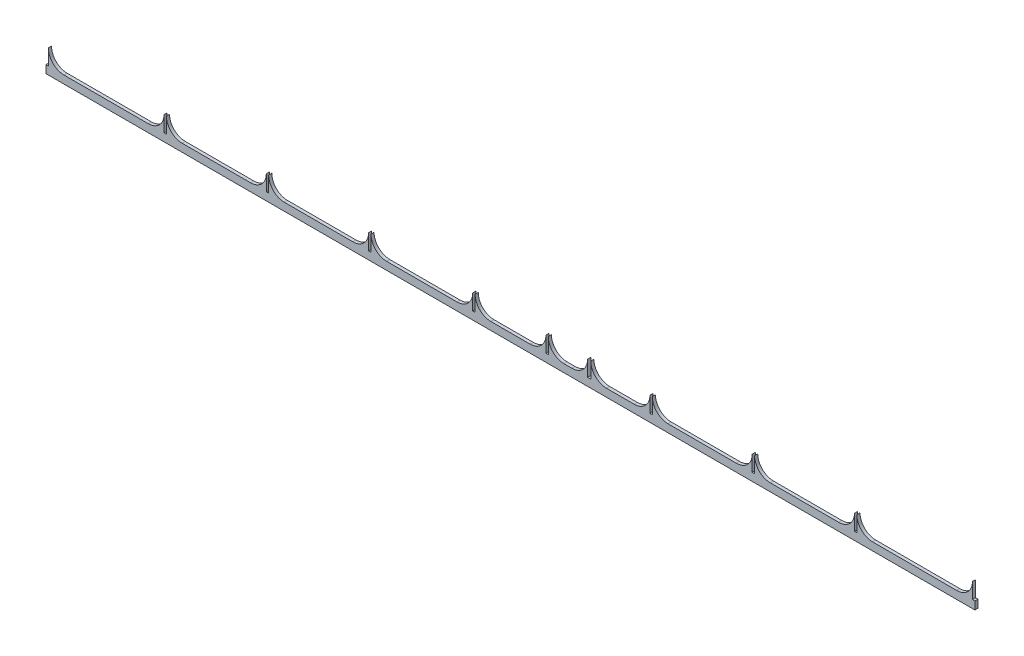
from build123d import *

# Parameters (mm, degrees)
EXTRUDE_1_DEPTH = 2


with BuildPart() as part:
    # Model → 凸台-拉伸1 (new body)
    with BuildSketch(Plane.XY):
        with BuildLine():
            Line((-3.696013755, 8.746558964), (49.803963076, 8.746558964))
            ThreePointArc((49.803963076, 8.746558964), (56.875030888, 11.675491152), (59.803963076, 18.746558964))
            Line((59.803963076, 18.746558964), (59.803963076, 8.746558964))
            Line((59.803963076, 8.746558964), (61.303963076, 8.746558964))
            Line((61.303963076, 8.746558964), (61.303963076, 18.746558964))
            ThreePointArc((61.303963076, 18.746558964), (64.232895264, 11.675491152), (71.303963076, 8.746558964))
            Line((71.303963076, 8.746558964), (114.803939907, 8.746558964))
            ThreePointArc((114.803939907, 8.746558964), (121.875007719, 11.675491152), (124.803939907, 18.746558964))
            Line((124.803939907, 18.746558964), (124.803939907, 8.746558964))
            Line((124.803939907, 8.746558964), (126.303939907, 8.746558964))
            Line((126.303939907, 8.746558964), (126.303939907, 18.746558964))
            ThreePointArc((126.303939907, 18.746558964), (129.232872095, 11.675491152), (136.303939907, 8.746558964))
            Line((136.303939907, 8.746558964), (179.803916738, 8.746558964))
            ThreePointArc((179.803916738, 8.746558964), (186.87498455, 11.675491152), (189.803916738, 18.746558964))
            Line((189.803916738, 18.746558964), (189.803916738, 8.746558964))
            Line((189.803916738, 8.746558964), (191.303916738, 8.746558964))
            Line((191.303916738, 8.746558964), (191.303916738, 18.746558964))
            ThreePointArc((191.303916738, 18.746558964), (194.232848927, 11.675491152), (201.303916739, 8.746558964))
            Line((201.303916739, 8.746558964), (246.003891639, 8.746558964))
            ThreePointArc((246.003891639, 8.746558964), (253.07495945, 11.675491152), (256.003891639, 18.746558964))
            Line((256.003891639, 18.746558964), (256.003891639, 8.746558964))
            Line((256.003891639, 8.746558964), (257.503891639, 8.746558964))
            Line((257.503891639, 8.746558964), (257.503891639, 18.746558964))
            ThreePointArc((257.503891639, 18.746558964), (260.432823827, 11.675491152), (267.503891639, 8.746558964))
            Line((267.503891639, 8.746558964), (275.474891639, 8.746558964))
            Line((275.474891639, 8.746558964), (292.503901751, 8.746558964))
            ThreePointArc((292.503901751, 8.746558964), (299.574969563, 11.675491152), (302.503901751, 18.746558964))
            Line((302.503901751, 18.746558964), (302.503901751, 8.746558964))
            Line((302.503901751, 8.746558964), (304.003901751, 8.746558964))
            Line((304.003901751, 8.746558964), (304.003901751, 18.746558964))
            ThreePointArc((304.003901751, 18.746558964), (306.932833939, 11.675491152), (314.003901751, 8.746558964))
            Line((314.003901751, 8.746558964), (319.003901751, 8.746558964))
            ThreePointArc((319.003901751, 8.746558964), (326.074969563, 11.675491152), (329.003901751, 18.746558964))
            Line((329.003901751, 18.746558964), (329.003901751, 8.746558964))
            Line((329.003901751, 8.746558964), (331.003901751, 8.746558964))
            Line((331.003901751, 8.746558964), (331.003901751, 18.746558964))
            ThreePointArc((331.003901751, 18.746558964), (333.932833939, 11.675491152), (341.003901751, 8.746558964))
            Line((341.003901751, 8.746558964), (358.600293959, 8.746558964))
            ThreePointArc((358.600293959, 8.746558964), (365.671361771, 11.675491152), (368.600293959, 18.746558964))
            Line((368.600293959, 18.746558964), (368.600293959, 8.746558964))
            Line((368.600293959, 8.746558964), (370.100293959, 8.746558964))
            Line((370.100293959, 8.746558964), (370.100293959, 18.746558964))
            ThreePointArc((370.100293959, 18.746558964), (373.029226147, 11.675491152), (380.10029396, 8.746558964))
            Line((380.10029396, 8.746558964), (423.600270791, 8.746558964))
            ThreePointArc((423.600270791, 8.746558964), (430.671338603, 11.675491152), (433.600270791, 18.746558964))
            Line((433.600270791, 18.746558964), (433.600270791, 8.746558964))
            Line((433.600270791, 8.746558964), (435.100270791, 8.746558964))
            Line((435.100270791, 8.746558964), (435.100270791, 18.746558964))
            ThreePointArc((435.100270791, 18.746558964), (438.029202979, 11.675491152), (445.100270791, 8.746558964))
            Line((445.100270791, 8.746558964), (488.600247622, 8.746558964))
            ThreePointArc((488.600247622, 8.746558964), (495.671315434, 11.675491152), (498.600247622, 18.746558964))
            Line((498.600247622, 18.746558964), (498.600247622, 8.746558964))
            Line((498.600247622, 8.746558964), (500.100247622, 8.746558964))
            Line((500.100247622, 8.746558964), (500.100247622, 18.746558964))
            ThreePointArc((500.100247622, 18.746558964), (503.02917981, 11.675491152), (510.100247622, 8.746558964))
            Line((510.100247622, 8.746558964), (563.600224453, 8.746558964))
            ThreePointArc((563.600224453, 8.746558964), (570.671292265, 11.675491152), (573.600224453, 18.746558964))
            Line((573.600224453, 18.746558964), (573.600224453, 8.746558964))
            Line((573.600224453, 8.746558964), (575.100224453, 8.746558964))
            Line((575.100224453, 8.746558964), (575.100224453, 3.746558964))
            Line((575.100224453, 3.746558964), (-15.196013755, 3.746558964))
            Line((-15.196013755, 3.746558964), (-15.196013755, 8.746558964))
            Line((-15.196013755, 8.746558964), (-13.696013755, 8.746558964))
            Line((-13.696013755, 8.746558964), (-13.696013755, 18.746558964))
            ThreePointArc((-13.696013755, 18.746558964), (-10.767081567, 11.675491152), (-3.696013755, 8.746558964))
        make_face()
    extrude(amount=EXTRUDE_1_DEPTH)


solid = part.part
